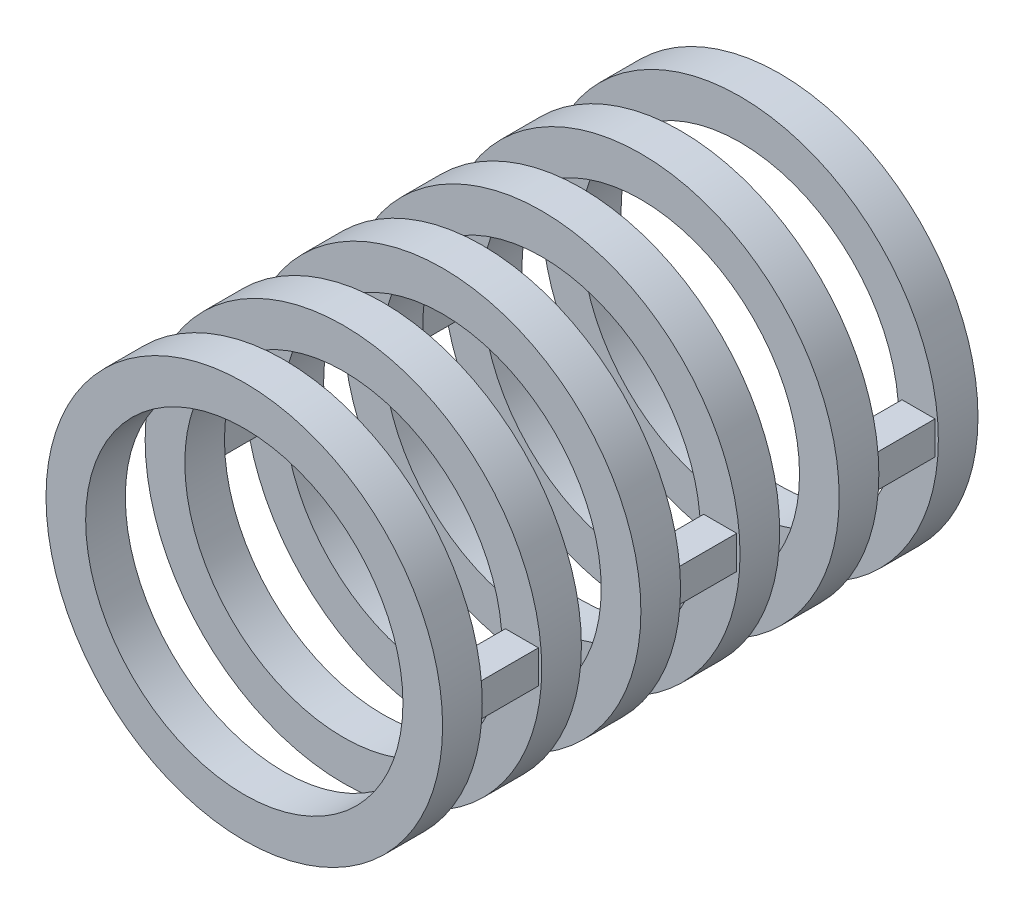
from build123d import *

# Parameters (mm, degrees)
SKETCH1_R   = 6
SKETCH1_R_2 = 4.8
COIL1_DEPTH = 1.2
SKETCH2_R   = 6
SKETCH2_R_2 = 4.8
COIL2_DEPTH = 1.2
SKETCH3_R   = 6
SKETCH3_R_2 = 4.8
COIL3_DEPTH = 1.2
SKETCH4_R   = 6
SKETCH4_R_2 = 4.8
COIL4_DEPTH = 1.2
SKETCH5_R   = 6
SKETCH5_R_2 = 4.8
COIL5_DEPTH = 1.2
SKETCH6_R   = 6
SKETCH6_R_2 = 4.8
COIL6_DEPTH = 1.2
SKETCH7_W   = 1
SKETCH7_H   = 1
LINK1_DEPTH = 1.8
SKETCH8_W   = 1
SKETCH8_H   = 1
LINK2_DEPTH = 1.8
SKETCH9_W   = 1
SKETCH9_H   = 1
LINK3_DEPTH = 1.8
SKETCH10_W  = 1
SKETCH10_H  = 1
LINK4_DEPTH = 1.8
SKETCH11_W  = 1
SKETCH11_H  = 1
LINK5_DEPTH = 1.8


with BuildPart() as part:
    # Sketch1 → Coil1 (new body)
    with BuildSketch(Plane.XY):
        Circle(SKETCH1_R)
        Circle(SKETCH1_R_2, mode=Mode.SUBTRACT)
    extrude(amount=COIL1_DEPTH)



with BuildPart() as body_2:
    # Sketch2 → Coil2 (new body)
    with BuildSketch(Plane.XY.offset(3)):
        Circle(SKETCH2_R)
        Circle(SKETCH2_R_2, mode=Mode.SUBTRACT)
    extrude(amount=COIL2_DEPTH)


with BuildPart() as body_3:
    # Sketch3 → Coil3 (new body)
    with BuildSketch(Plane.XY.offset(6)):
        Circle(SKETCH3_R)
        Circle(SKETCH3_R_2, mode=Mode.SUBTRACT)
    extrude(amount=COIL3_DEPTH)


with BuildPart() as body_4:
    # Sketch4 → Coil4 (new body)
    with BuildSketch(Plane.XY.offset(9)):
        Circle(SKETCH4_R)
        Circle(SKETCH4_R_2, mode=Mode.SUBTRACT)
    extrude(amount=COIL4_DEPTH)


with BuildPart() as body_5:
    # Sketch5 → Coil5 (new body)
    with BuildSketch(Plane.XY.offset(12)):
        Circle(SKETCH5_R)
        Circle(SKETCH5_R_2, mode=Mode.SUBTRACT)
    extrude(amount=COIL5_DEPTH)


with BuildPart() as body_6:
    # Sketch6 → Coil6 (new body)
    with BuildSketch(Plane.XY.offset(15)):
        Circle(SKETCH6_R)
        Circle(SKETCH6_R_2, mode=Mode.SUBTRACT)
    extrude(amount=COIL6_DEPTH)


with BuildPart() as part_1:
    add(part.part)

    add(body_2.part)  # Link1 merges body 2
    # Sketch7 → Link1 (add)
    with BuildSketch(Plane.XY.offset(1.2)):
        with Locations((5.4, 0)):
            Rectangle(SKETCH7_W, SKETCH7_H)
    extrude(amount=LINK1_DEPTH)


    add(body_3.part)  # Link2 merges body 3
    # Sketch8 → Link2 (add)
    with BuildSketch(Plane.XY.offset(4.2)):
        with Locations((-5.4, 0)):
            Rectangle(SKETCH8_W, SKETCH8_H)
    extrude(amount=LINK2_DEPTH)


    add(body_4.part)  # Link3 merges body 4
    # Sketch9 → Link3 (add)
    with BuildSketch(Plane.XY.offset(7.2)):
        with Locations((5.4, 0)):
            Rectangle(SKETCH9_W, SKETCH9_H)
    extrude(amount=LINK3_DEPTH)


    add(body_5.part)  # Link4 merges body 5
    # Sketch10 → Link4 (add)
    with BuildSketch(Plane.XY.offset(10.2)):
        with Locations((-5.4, 0)):
            Rectangle(SKETCH10_W, SKETCH10_H)
    extrude(amount=LINK4_DEPTH)


    add(body_6.part)  # Link5 merges body 6
    # Sketch11 → Link5 (add)
    with BuildSketch(Plane.XY.offset(13.2)):
        with Locations((5.4, 0)):
            Rectangle(SKETCH11_W, SKETCH11_H)
    extrude(amount=LINK5_DEPTH)


solid = part_1.part
